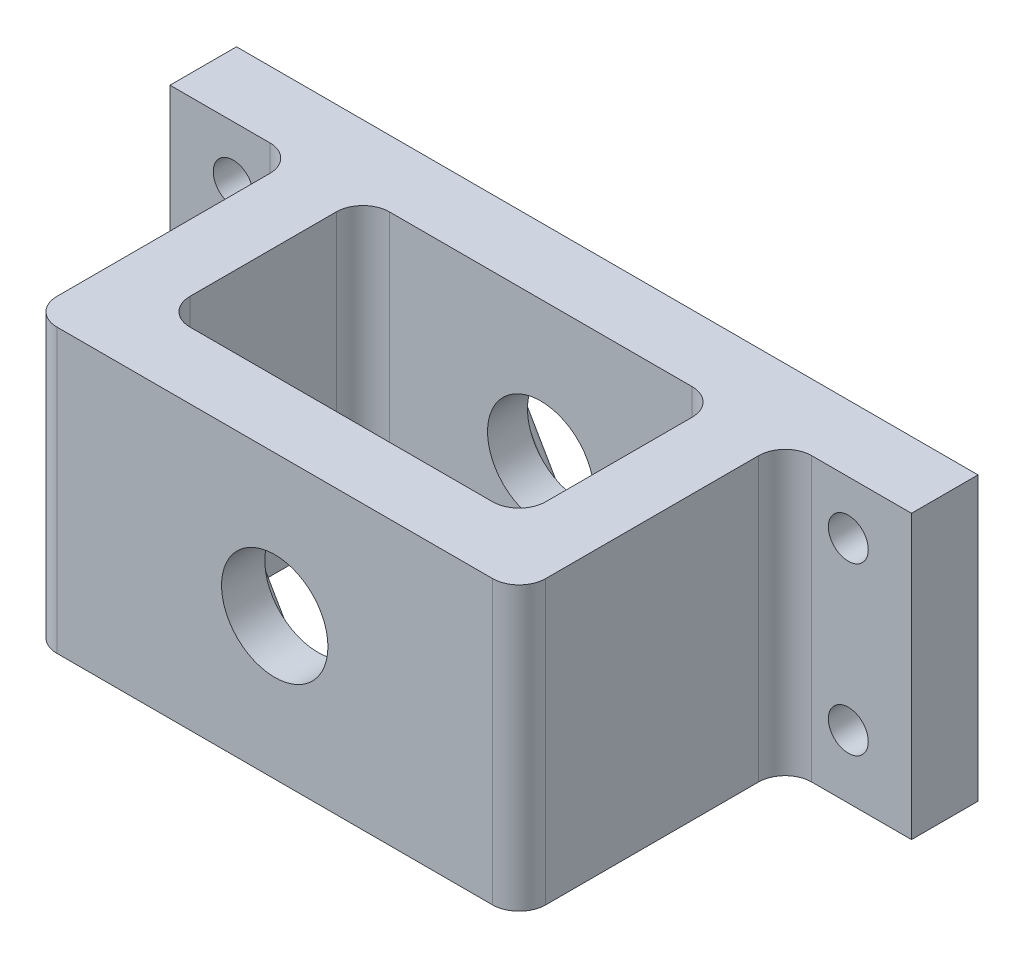
from build123d import *

# Parameters (mm, degrees)
SKETCH6_R            = 4
BOSS_EXTRUDE8_DEPTH  = 3
SKETCH6_10_W         = 55.75
SKETCH6_10_H         = 21.25
BOSS_EXTRUDE10_DEPTH = 5
SKETCH7_R            = 1.5
CUT_EXTRUDE7_DEPTH   = 60.871737907
SKETCH8_W            = 5
SKETCH8_H            = 21.25
BOSS_EXTRUDE11_DEPTH = 15
SKETCH9_W            = 36.75
SKETCH9_H            = 21.25
BOSS_EXTRUDE12_DEPTH = 5
SKETCH10_R           = 4
BOSS_EXTRUDE13_DEPTH = 3.25
FILLET2_R            = 2
FILLET3_R            = 0.75


with BuildPart() as part:
    # Sketch6 → Boss-Extrude8 (new body)
    with BuildSketch(Plane.XY):
        Polygon((31.122595264, 5), (34.370190528, 10.625), (31.122595264, 16.25), (24.627404736, 16.25), (21.379809472, 10.625), (24.627404736, 5), align=None)
        with Locations((27.875, 10.625)):
            Circle(SKETCH6_R, mode=Mode.SUBTRACT)
    extrude(amount=-BOSS_EXTRUDE8_DEPTH)

    # Sketch6<10> → Boss-Extrude10 (add)
    with BuildSketch(Plane.XY):
        with Locations((27.875, 10.625)):
            Rectangle(SKETCH6_10_W, SKETCH6_10_H)
        Polygon((31.122595264, 16.25), (34.370190528, 10.625), (31.122595264, 5), (24.627404736, 5), (21.379809472, 10.625), (24.627404736, 16.25), align=None, mode=Mode.SUBTRACT)
    extrude(amount=-BOSS_EXTRUDE10_DEPTH)

    # Sketch7 → Cut-Extrude7 (cut, through all)
    with BuildSketch(Plane.XY):
        with Locations((4.75, 17.25)):
            Circle(SKETCH7_R)
        with Locations((4.75, 4.75)):
            Circle(SKETCH7_R)
        with Locations((51, 4.75)):
            Circle(SKETCH7_R)
        with Locations((51, 17.25)):
            Circle(SKETCH7_R)
    extrude(amount=-CUT_EXTRUDE7_DEPTH, mode=Mode.SUBTRACT)

    # Sketch8 → Boss-Extrude11 (add)
    with BuildSketch(Plane.XY):
        with Locations((12, 10.625)):
            Rectangle(SKETCH8_W, SKETCH8_H)
        with Locations((43.75, 10.625)):
            Rectangle(SKETCH8_W, SKETCH8_H)
    extrude(amount=BOSS_EXTRUDE11_DEPTH)

    # Sketch9 → Boss-Extrude12 (add)
    with BuildSketch(Plane.XY.offset(15)):
        with Locations((27.875, 10.625)):
            Rectangle(SKETCH9_W, SKETCH9_H)
        Polygon((21.379809472, 10.625), (24.627404736, 16.25), (31.122595264, 16.25), (34.370190528, 10.625), (31.122595264, 5), (24.627404736, 5), align=None, mode=Mode.SUBTRACT)
    extrude(amount=BOSS_EXTRUDE12_DEPTH)

    # Sketch10 → Boss-Extrude13 (add)
    with BuildSketch(Plane.XY.offset(20)):
        Polygon((24.627404736, 16.25), (21.379809472, 10.625), (24.627404736, 5), (31.122595264, 5), (34.370190528, 10.625), (31.122595264, 16.25), align=None)
        with Locations((27.875, 10.625)):
            Circle(SKETCH10_R, mode=Mode.SUBTRACT)
    extrude(amount=-BOSS_EXTRUDE13_DEPTH)

    # Fillet2
    fillet2_edges = [part.edges().sort_by_distance(p)[0] for p in [
        (41.25, 10.625, 15),
        (14.5, 10.625, 15),
        (9.5, 10.625, 0),
        (14.5, 10.625, 0),
        (41.25, 10.625, 0),
        (46.25, 10.625, 0),
        (9.5, 10.625, 20),
        (46.25, 10.625, 20),
    ]]
    fillet(fillet2_edges, radius=FILLET2_R)

    # Fillet3
    fillet3_edges = [part.edges().sort_by_distance(p)[0] for p in [
        (23.003607104, 7.8125, 15),
        (27.875, 5, 15),
        (32.746392896, 7.8125, 15),
        (32.746392896, 13.4375, 15),
        (27.875, 16.25, 15),
        (23.003607104, 13.4375, 15),
        (32.746392896, 7.8125, -5),
        (32.746392896, 13.4375, -5),
        (27.875, 16.25, -5),
        (23.003607104, 13.4375, -5),
        (23.003607104, 7.8125, -5),
        (27.875, 5, -5),
    ]]
    fillet(fillet3_edges, radius=FILLET3_R)


solid = part.part
